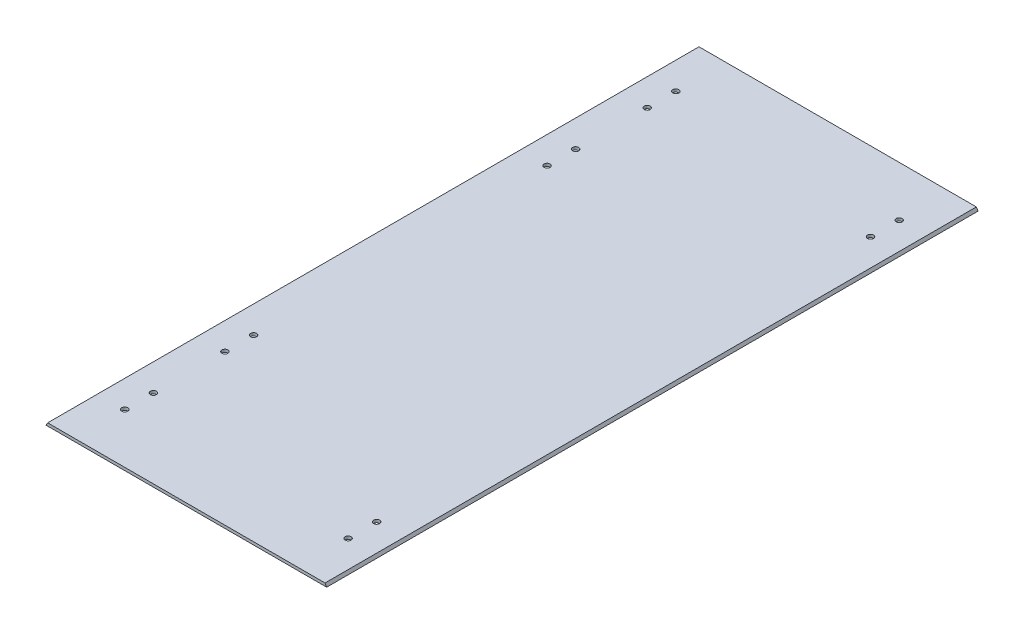
from build123d import *

# Parameters (mm, degrees)
EXTRUDE_1_DEPTH     = 455
SKETCH_3_R          = 2.1
CUT_EXTRUDE_1_DEPTH = 466.453246739


with BuildPart() as part:
    # 草图2 → 凸台-拉伸1 (new body)
    with BuildSketch(Plane.XY):
        Polygon((-98, -1), (-96.845299462, 1), (96.915299462, 1), (98.07, -1), align=None)
    extrude(amount=-EXTRUDE_1_DEPTH)

    # 草图3 → 切除-拉伸1 (cut, through all)
    with BuildSketch(Plane(origin=(0, -1, 0), x_dir=(-1, 0, 0), z_dir=(0, -1, 0))):
        with Locations(Location((78, 35, 0), (0, 0, 90))):
            Circle(SKETCH_3_R)
        with Locations(Location((78, 55, 0), (0, 0, 90))):
            Circle(SKETCH_3_R)
        with Locations(Location((-78, 55, 0), (0, 0, 270))):
            Circle(SKETCH_3_R)
        with Locations(Location((-78, 35, 0), (0, 0, 270))):
            Circle(SKETCH_3_R)
        with Locations(Location((-78, 420, 0), (0, 0, 90))):
            Circle(SKETCH_3_R)
        with Locations(Location((-78, 400, 0), (0, 0, 90))):
            Circle(SKETCH_3_R)
        with Locations(Location((78, 400, 0), (0, 0, 270))):
            Circle(SKETCH_3_R)
        with Locations(Location((78, 420, 0), (0, 0, 270))):
            Circle(SKETCH_3_R)
        with Locations(Location((78, 105, 0), (0, 0, 90))):
            Circle(SKETCH_3_R)
        with Locations(Location((78, 125, 0), (0, 0, 90))):
            Circle(SKETCH_3_R)
        with Locations(Location((78, 350, 0), (0, 0, 270))):
            Circle(SKETCH_3_R)
        with Locations(Location((78, 330, 0), (0, 0, 270))):
            Circle(SKETCH_3_R)
    extrude(amount=-CUT_EXTRUDE_1_DEPTH, mode=Mode.SUBTRACT)


solid = part.part
